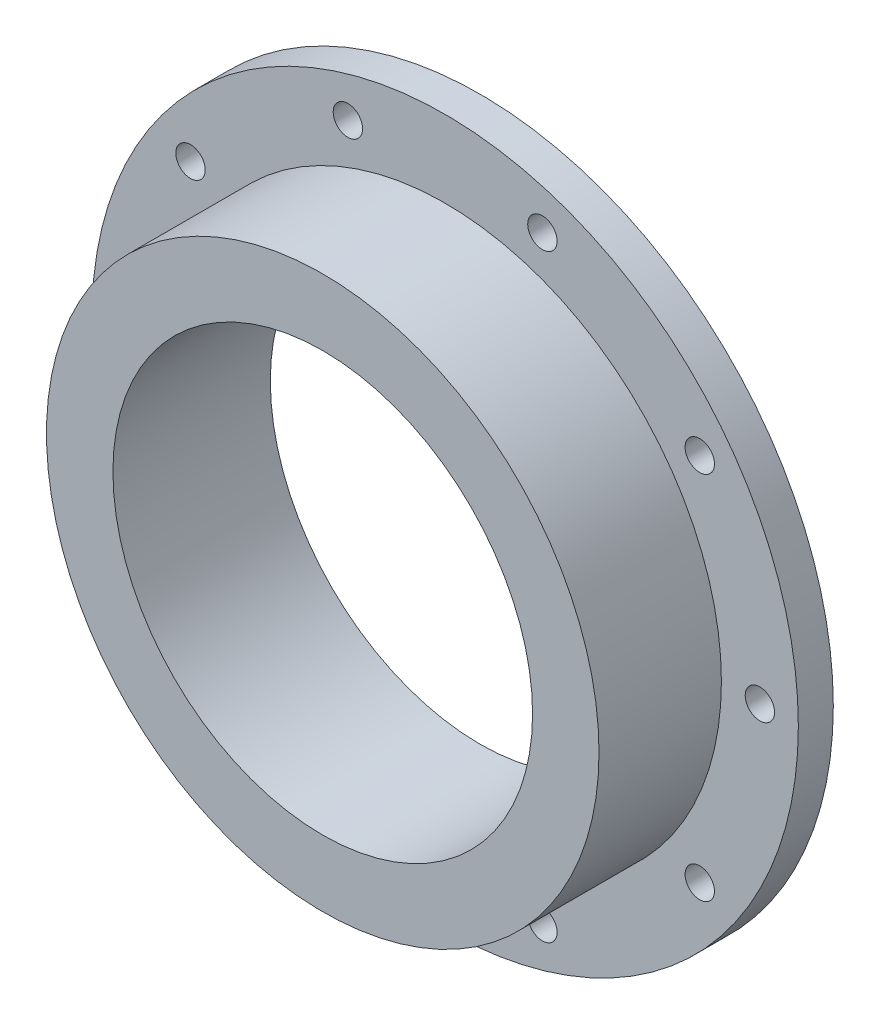
from build123d import *

# Parameters (mm, degrees)
SKETCH1_W                      = 101
SKETCH1_H                      = 10
SKETCH2_R                      = 79
BOSS_EXTRUDE1_DEPTH            = 35
F_8_4_8_4_DIAMETER_HOLE1_D     = 8.4
F_8_4_8_4_DIAMETER_HOLE1_DEPTH = 45
HOLE1_D                        = 120


with BuildPart() as part:
    # Sketch1 → Revolve1 (revolve)
    with BuildSketch(Plane(origin=(0, 0, 0), x_dir=(1, 0, 0), z_dir=(0, 1, 0))):
        with Locations((50.5, 5)):
            Rectangle(SKETCH1_W, SKETCH1_H)
    revolve(axis=Axis((0, 0, -10), (0, 0, 1)))

    # Sketch2 → Boss-Extrude1 (add)
    with BuildSketch(Plane.XY):
        Circle(SKETCH2_R)
    extrude(amount=BOSS_EXTRUDE1_DEPTH)

    # Sketch3 → Cut-Revolve1 (revolve, cut)
    with BuildSketch(Plane(origin=(0, 69.5, 0), x_dir=(1, 0, 0), z_dir=(0, 1, 0)), mode=Mode.PRIVATE) as cut_revolve1_sk:
        Polygon((3.3235, 10), (0, 10), (0, -5), (3.3235, -3.003039733), (3.3235, 0), align=None)
    revolve(cut_revolve1_sk.sketch.rotate(Axis((0, 69.5, -10), (0, 0, 1)), 180), axis=Axis((0, 69.5, -10), (0, 0, 1)), mode=Mode.SUBTRACT)

    # Sketch4 → Cut-Revolve2 (revolve, cut)
    with BuildSketch(Plane(origin=(0, 56.226681109, 0), x_dir=(1, 0, 0), z_dir=(0, 1, 0)), mode=Mode.PRIVATE) as cut_revolve2_sk:
        Polygon((44.174575034, 10), (40.851075034, 10), (40.851075034, -5), (44.174575034, -3.003039733), (44.174575034, 0), align=None)
    revolve(cut_revolve2_sk.sketch.rotate(Axis((40.851075034, 56.226681109, -10), (0, 0, 1)), 180), axis=Axis((40.851075034, 56.226681109, -10), (0, 0, 1)), mode=Mode.SUBTRACT)

    # Sketch5 → Cut-Revolve3 (revolve, cut)
    with BuildSketch(Plane(origin=(0, 21.476681109, 0), x_dir=(1, 0, 0), z_dir=(0, 1, 0)), mode=Mode.PRIVATE) as cut_revolve3_sk:
        Polygon((69.421927883, 10), (66.098427883, 10), (66.098427883, -5), (69.421927883, -3.003039733), (69.421927883, 0), align=None)
    revolve(cut_revolve3_sk.sketch.rotate(Axis((66.098427883, 21.476681109, -10), (0, 0, 1)), 180), axis=Axis((66.098427883, 21.476681109, -10), (0, 0, 1)), mode=Mode.SUBTRACT)

    # Sketch6 → Cut-Revolve4 (revolve, cut)
    with BuildSketch(Plane(origin=(0, -21.476681109, 0), x_dir=(1, 0, 0), z_dir=(0, 1, 0)), mode=Mode.PRIVATE) as cut_revolve4_sk:
        Polygon((69.421927883, 10), (66.098427883, 10), (66.098427883, -5), (69.421927883, -3.003039733), (69.421927883, 0), align=None)
    revolve(cut_revolve4_sk.sketch.rotate(Axis((66.098427883, -21.476681109, -10), (0, 0, 1)), 180), axis=Axis((66.098427883, -21.476681109, -10), (0, 0, 1)), mode=Mode.SUBTRACT)

    # Sketch7 → Cut-Revolve5 (revolve, cut)
    with BuildSketch(Plane(origin=(0, -56.226681109, 0), x_dir=(1, 0, 0), z_dir=(0, 1, 0)), mode=Mode.PRIVATE) as cut_revolve5_sk:
        Polygon((44.174575034, 10), (40.851075034, 10), (40.851075034, -5), (44.174575034, -3.003039733), (44.174575034, 0), align=None)
    revolve(cut_revolve5_sk.sketch.rotate(Axis((40.851075034, -56.226681109, -10), (0, 0, 1)), 180), axis=Axis((40.851075034, -56.226681109, -10), (0, 0, 1)), mode=Mode.SUBTRACT)

    # Sketch8 → Cut-Revolve6 (revolve, cut)
    with BuildSketch(Plane(origin=(0, -69.5, 0), x_dir=(1, 0, 0), z_dir=(0, 1, 0)), mode=Mode.PRIVATE) as cut_revolve6_sk:
        Polygon((3.3235, 10), (0, 10), (0, -5), (3.3235, -3.003039733), (3.3235, 0), align=None)
    revolve(cut_revolve6_sk.sketch.rotate(Axis((0, -69.5, -10), (0, 0, 1)), 180), axis=Axis((0, -69.5, -10), (0, 0, 1)), mode=Mode.SUBTRACT)

    # Sketch9 → Cut-Revolve7 (revolve, cut)
    with BuildSketch(Plane(origin=(0, -56.226681109, 0), x_dir=(1, 0, 0), z_dir=(0, 1, 0)), mode=Mode.PRIVATE) as cut_revolve7_sk:
        Polygon((-37.527575034, 10), (-40.851075034, 10), (-40.851075034, -5), (-37.527575034, -3.003039733), (-37.527575034, 0), align=None)
    revolve(cut_revolve7_sk.sketch.rotate(Axis((-40.851075034, -56.226681109, -10), (0, 0, 1)), 180), axis=Axis((-40.851075034, -56.226681109, -10), (0, 0, 1)), mode=Mode.SUBTRACT)

    # Sketch10 → Cut-Revolve8 (revolve, cut)
    with BuildSketch(Plane(origin=(0, -21.476681109, 0), x_dir=(1, 0, 0), z_dir=(0, 1, 0)), mode=Mode.PRIVATE) as cut_revolve8_sk:
        Polygon((-62.774927883, 10), (-66.098427883, 10), (-66.098427883, -5), (-62.774927883, -3.003039733), (-62.774927883, 0), align=None)
    revolve(cut_revolve8_sk.sketch.rotate(Axis((-66.098427883, -21.476681109, -10), (0, 0, 1)), 180), axis=Axis((-66.098427883, -21.476681109, -10), (0, 0, 1)), mode=Mode.SUBTRACT)

    # Sketch11 → Cut-Revolve9 (revolve, cut)
    with BuildSketch(Plane(origin=(0, 21.476681109, 0), x_dir=(1, 0, 0), z_dir=(0, 1, 0)), mode=Mode.PRIVATE) as cut_revolve9_sk:
        Polygon((-62.774927883, 10), (-66.098427883, 10), (-66.098427883, -5), (-62.774927883, -3.003039733), (-62.774927883, 0), align=None)
    revolve(cut_revolve9_sk.sketch.rotate(Axis((-66.098427883, 21.476681109, -10), (0, 0, 1)), 180), axis=Axis((-66.098427883, 21.476681109, -10), (0, 0, 1)), mode=Mode.SUBTRACT)

    # Sketch12 → Cut-Revolve10 (revolve, cut)
    with BuildSketch(Plane(origin=(0, 56.226681109, 0), x_dir=(1, 0, 0), z_dir=(0, 1, 0)), mode=Mode.PRIVATE) as cut_revolve10_sk:
        Polygon((-37.527575034, 10), (-40.851075034, 10), (-40.851075034, -5), (-37.527575034, -3.003039733), (-37.527575034, 0), align=None)
    revolve(cut_revolve10_sk.sketch.rotate(Axis((-40.851075034, 56.226681109, -10), (0, 0, 1)), 180), axis=Axis((-40.851075034, 56.226681109, -10), (0, 0, 1)), mode=Mode.SUBTRACT)

    # Ø8.4 (8.4) Diameter Hole1
    with Locations(Plane(origin=(0, 0, -10), x_dir=(-1, 0, 0), z_dir=(0, 0, -1))):
        with Locations((27.811529494, 85.595086467), (72.811529494, 52.900672706), (90, 0), (72.811529494, -52.900672706), (27.811529494, -85.595086467), (-27.811529494, -85.595086467), (-72.811529494, -52.900672706), (-90, 0), (-72.811529494, 52.900672706), (-27.811529494, 85.595086467)):
            Hole(F_8_4_8_4_DIAMETER_HOLE1_D / 2, depth=F_8_4_8_4_DIAMETER_HOLE1_DEPTH)

    # Hole1 (through all)
    with Locations(Plane(origin=(0, 0, -10), x_dir=(-1, 0, 0), z_dir=(0, 0, -1))):
        with Locations((0, 0)):
            Hole(HOLE1_D / 2)


solid = part.part
